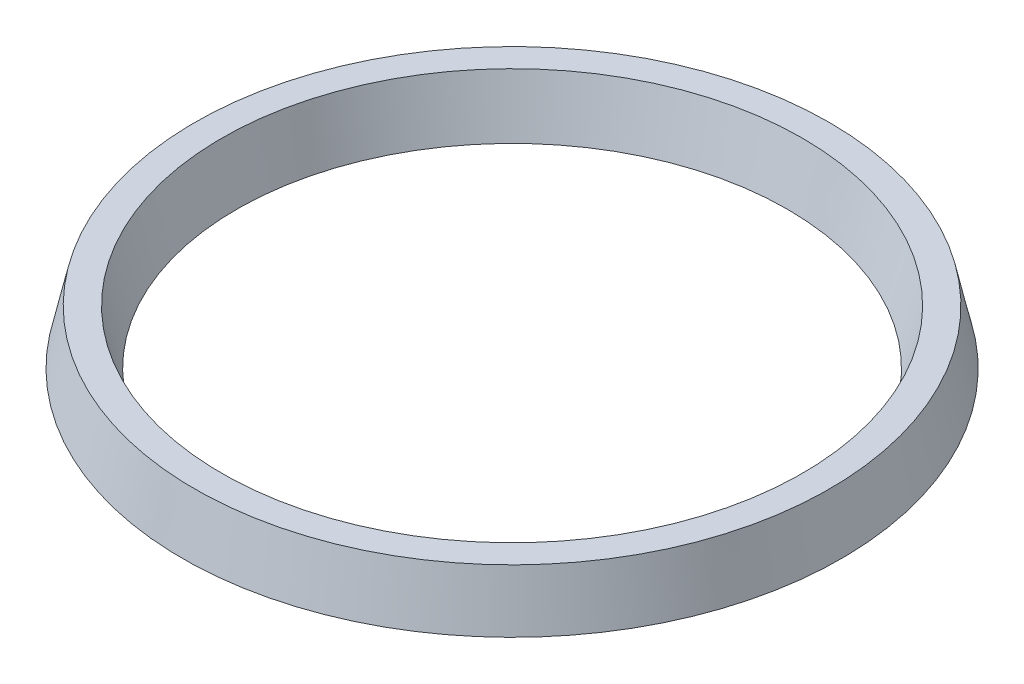
from build123d import *


with BuildPart() as part:
    # Sketch1 → Revolve1 (revolve)
    with BuildSketch(Plane.XY, mode=Mode.PRIVATE) as revolve1_sk:
        with BuildLine():
            Line((3, 6), (-3, 6))
            Line((-3, 6), (-6.304933771, -6))
            Line((-6.304933771, -6), (-3.304933771, -6))
            Line((-3.304933771, -6), (-2.037757503, -1.398965223))
            ThreePointArc((-2.037757503, -1.398965223), (-0.143292826, 0.008803125), (1.681704358, -1.487924443))
            Line((1.681704358, -1.487924443), (2.695066229, -6))
            Line((2.695066229, -6), (5.695066229, -6))
            Line((5.695066229, -6), (3, 6))
        make_face()
    revolve(revolve1_sk.sketch.rotate(Axis((-67.31, 0, 0), (0, 1, 0)), 90), axis=Axis((-67.31, 0, 0), (0, 1, 0)))


solid = part.part
